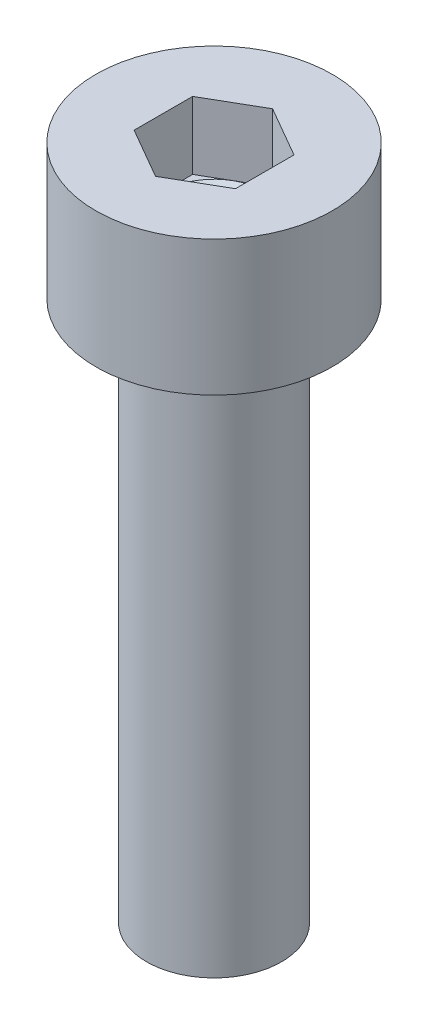
from build123d import *

# Parameters (mm, degrees)
CUT_EXTRUDE1_DEPTH = 2


with BuildPart() as part:
    # Sketch1 → Revolve1 (revolve)
    with BuildSketch(Plane.XY, mode=Mode.PRIVATE) as revolve1_sk:
        Polygon((0, 0), (3.5, 0), (3.5, -4), (2, -4), (2, -20), (0, -20), align=None)
    revolve(revolve1_sk.sketch.rotate(Axis((0, 0, 0), (0, -1, 0)), 180), axis=Axis((0, 0, 0), (0, -1, 0)))

    # Sketch2 → Cut-Revolve1 (revolve, cut)
    with BuildSketch(Plane.XY, mode=Mode.PRIVATE) as cut_revolve1_sk:
        Polygon((1.5, 0), (1.5, -2), (0, -2.866025404), (0, 0), align=None)
    revolve(cut_revolve1_sk.sketch.rotate(Axis((0, 0, 0), (0, -1, 0)), 180), axis=Axis((0, 0, 0), (0, -1, 0)), mode=Mode.SUBTRACT)

    # Sketch3 → Cut-Extrude1 (cut)
    with BuildSketch(Plane(origin=(0, 0, 0), x_dir=(1, 0, 0), z_dir=(0, 1, 0))):
        Polygon((0, 1.732050808), (-1.5, 0.866025404), (-1.5, -0.866025404), (0, -1.732050808), (1.5, -0.866025404), (1.5, 0.866025404), align=None)
    extrude(amount=-CUT_EXTRUDE1_DEPTH, mode=Mode.SUBTRACT)


solid = part.part
